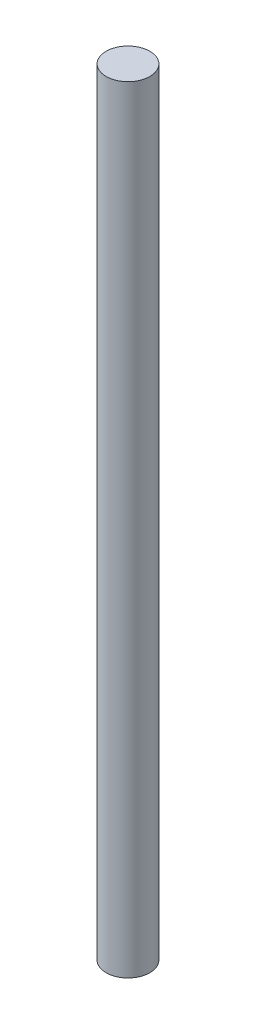
from build123d import *

# Parameters (mm, degrees)
ESQUISSE1_R        = 2
BOSS_EXTRU_1_DEPTH = 71


with BuildPart() as part:
    # Esquisse1 → Boss.-Extru.1 (new body)
    with BuildSketch(Plane(origin=(0, 0, 0), x_dir=(1, 0, 0), z_dir=(0, 1, 0))):
        with Locations(Location((0, 0, 0), (0, 0, 270))):
            Circle(ESQUISSE1_R)
    extrude(amount=BOSS_EXTRU_1_DEPTH)


solid = part.part
